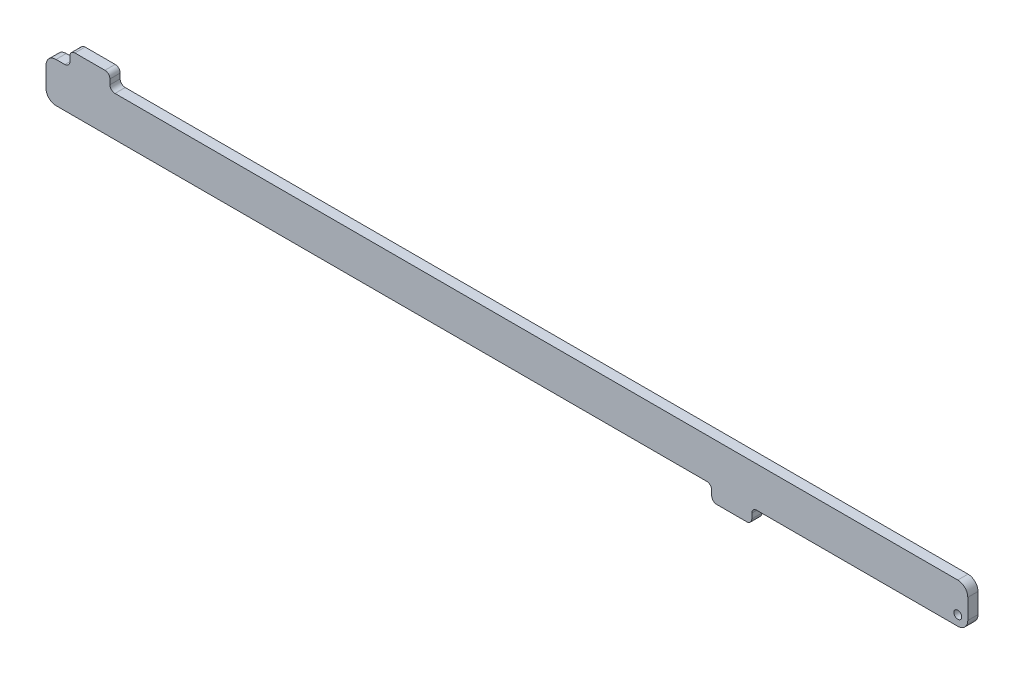
from build123d import *

# Parameters (mm, degrees)
SKETCH1_R           = 2.4892
BOSS_EXTRUDE1_DEPTH = 6.477
FILLET2_R           = 6.35
FILLET3_R           = 3.175


with BuildPart() as part:
    # Sketch1 → Boss-Extrude1 (new body)
    with BuildSketch(Plane.XY):
        Polygon((0, 0), (40.53078, 0), (421.903292844, 0), (421.903292844, -9.525), (447.303292844, -9.525), (447.303292844, 0), (584.2, 0), (584.2, 25.4), (40.530665192, 25.4), (40.530665192, 34.925), (15.130665192, 34.925), (15.130665192, 25.4), (0, 25.4), align=None)
        with Locations((577.85, 6.35)):
            Circle(SKETCH1_R, mode=Mode.SUBTRACT)
    extrude(amount=BOSS_EXTRUDE1_DEPTH)

    # Fillet2
    fillet2_edges = [part.edges().sort_by_distance(p)[0] for p in [
        (0, 0, 3.2385),
        (0, 25.4, 3.2385),
        (584.2, 25.4, 3.2385),
        (584.2, 0, 3.2385),
    ]]
    fillet(fillet2_edges, radius=FILLET2_R)


with BuildPart() as body_2:
    # Mirror2: mirrored copy
    add(part.part.mirror(Plane.XY))

    # Fillet3
    fillet3_edges = [body_2.edges().sort_by_distance(p)[0] for p in [
        (447.303292844, -9.525, -3.2385),
        (421.903292844, -9.525, -3.2385),
        (421.903292844, 0, -3.2385),
        (15.130665192, 25.4, -3.2385),
        (15.130665192, 34.925, -3.2385),
        (40.530665192, 34.925, -3.2385),
        (40.530665192, 25.4, -3.2385),
        (447.303292844, 0, -3.2385),
    ]]
    fillet(fillet3_edges, radius=FILLET3_R)


solid = body_2.part
